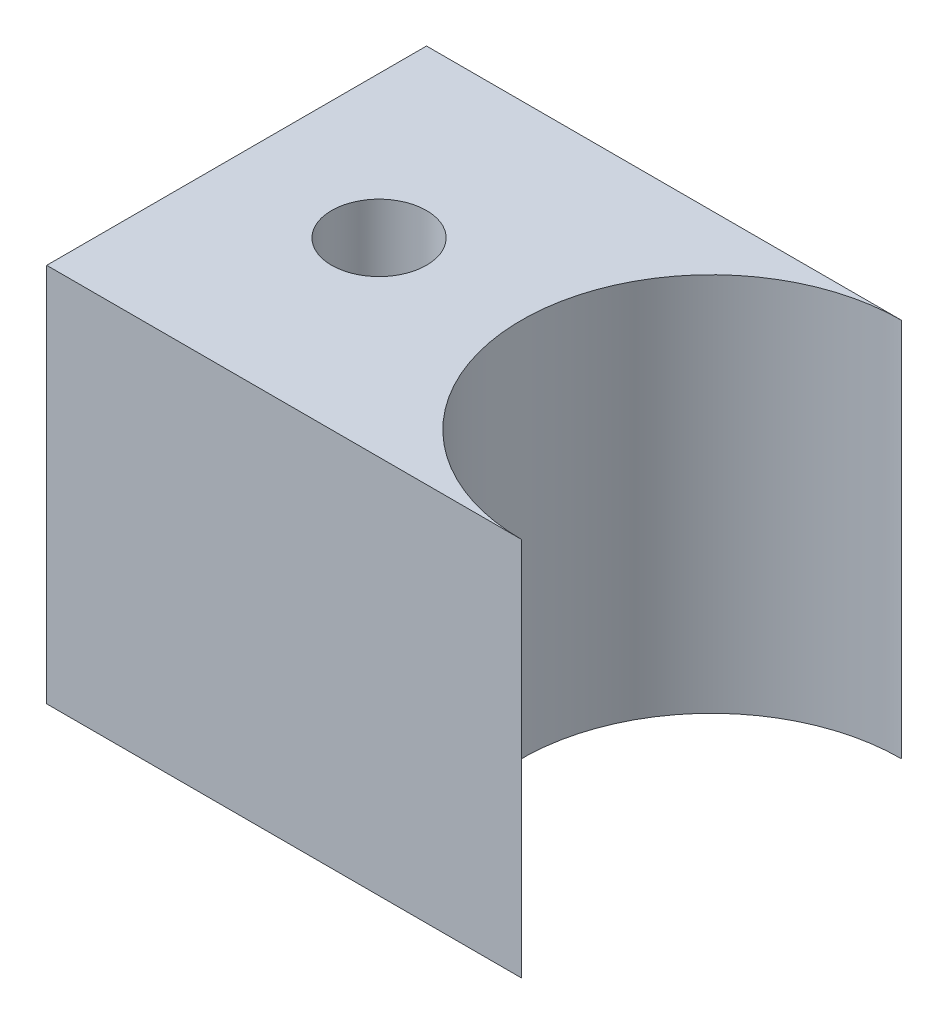
from build123d import *

# Parameters (mm, degrees)
SKETCH2_R           = 3.175
BOSS_EXTRUDE2_DEPTH = 25.4
SKETCH3_R           = 4.7625
CUT_EXTRUDE1_DEPTH  = 14.2875


with BuildPart() as part:
    # Sketch2 → Boss-Extrude2 (new body)
    with BuildSketch(Plane(origin=(0, 0, 0), x_dir=(1, 0, 0), z_dir=(0, 1, 0))):
        with BuildLine():
            Line((-15.875, 12.7), (-15.875, -12.7))
            Line((-15.875, -12.7), (15.875, -12.7))
            ThreePointArc((15.875, -12.7), (3.175, 0), (15.875, 12.7))
            Line((15.875, 12.7), (-15.875, 12.7))
        make_face()
        with Locations(Location((-6.35, 0, 0), (0, 0, 270))):
            Circle(SKETCH2_R, mode=Mode.SUBTRACT)
    extrude(amount=BOSS_EXTRUDE2_DEPTH)

    # Sketch3 → Cut-Extrude1 (cut)
    with BuildSketch(Plane.ZY.offset(15.875)):
        with Locations((0, 12.7)):
            Circle(SKETCH3_R)
    extrude(amount=-CUT_EXTRUDE1_DEPTH, mode=Mode.SUBTRACT)


solid = part.part
